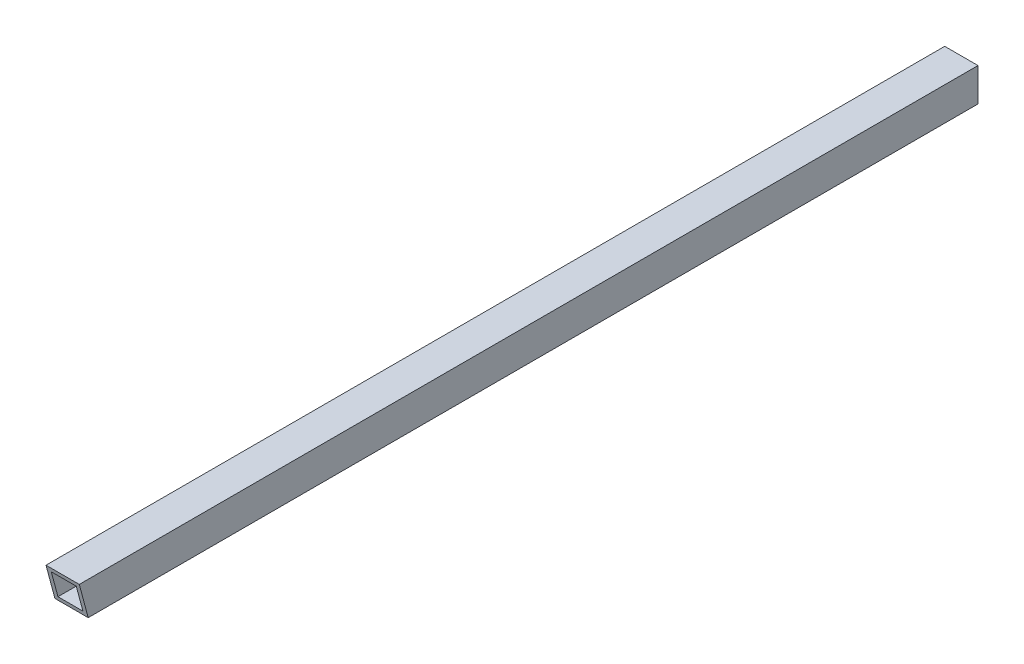
from build123d import *

# Parameters (mm, degrees)
SKETCH1_W           = 25.4
SKETCH1_H           = 25.4
SKETCH1_W_2         = 19.05
SKETCH1_H_2         = 19.05
BOSS_EXTRUDE1_DEPTH = 685.8
SKETCH3_W           = 25.4
SKETCH3_H           = 26.296014982
CUT_EXTRUDE2_DEPTH  = 663.667216417


with BuildPart() as part:
    # Sketch1 → Boss-Extrude1 (new body)
    with BuildSketch(Plane.XY):
        Rectangle(SKETCH1_W, SKETCH1_H)
        Rectangle(SKETCH1_W_2, SKETCH1_H_2, mode=Mode.SUBTRACT)
    extrude(amount=BOSS_EXTRUDE1_DEPTH)

    # Sketch3 → Cut-Extrude2 (cut, through all)
    with BuildSketch(Plane(origin=(0, -170.599261314, 636.685110958), x_dir=(-1, 0, 0), z_dir=(0, -0.25881904510250786, 0.9659258262890718))):
        with Locations((0, -176.617351634)):
            Rectangle(SKETCH3_W, SKETCH3_H)
    extrude(amount=CUT_EXTRUDE2_DEPTH, mode=Mode.SUBTRACT)


solid = part.part
